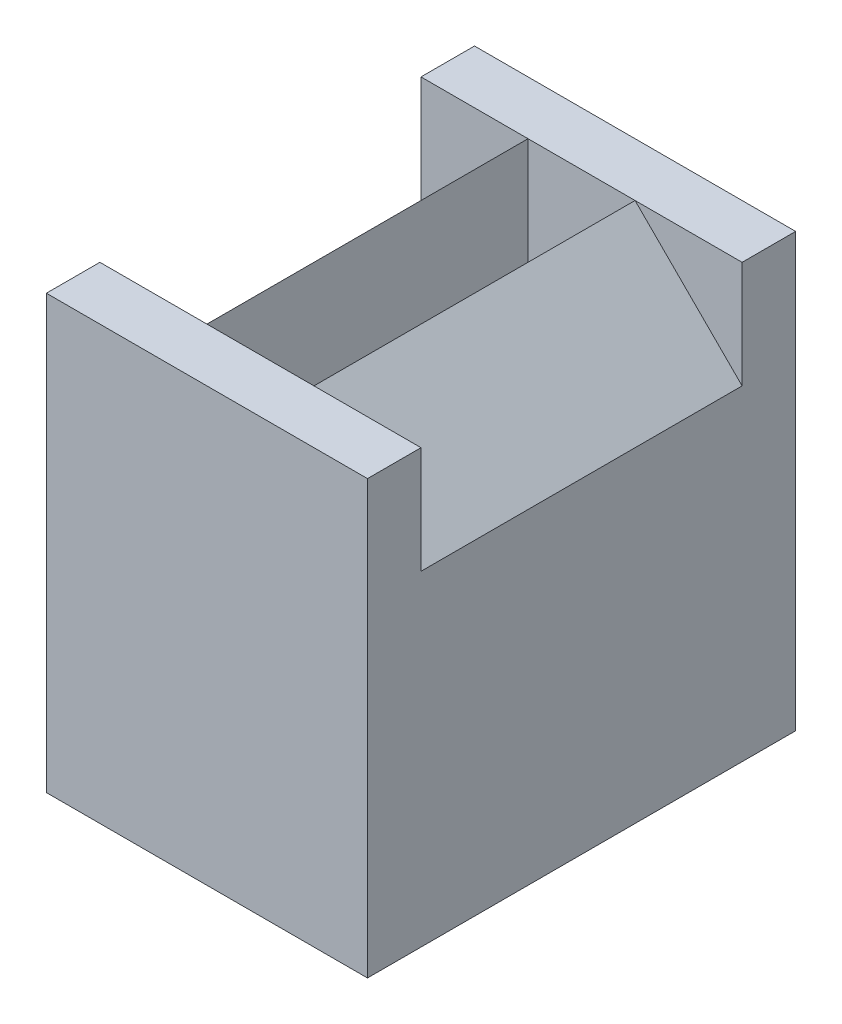
from build123d import *

# Parameters (mm, degrees)
BOSS_EXTRUDE2_DEPTH = 40
SKETCH2_5_W         = 20
SKETCH2_5_H         = 20
BOSS_EXTRUDE3_DEPTH = 10


with BuildPart() as part:
    # Sketch2 → Boss-Extrude2 (new body)
    with BuildSketch(Plane.XY):
        Polygon((30, 20.406682394), (10, 40.406682394), (10, 20.406682394), (-10, 20.406682394), (-10, 40.406682394), (-30, 20.406682394), (-30, -40.406682394), (30, -40.406682394), align=None)
    extrude(amount=BOSS_EXTRUDE2_DEPTH)

    # Sketch2<5> → Boss-Extrude3 (add)
    with BuildSketch(Plane.XY):
        Polygon((30, 40.406682394), (10, 40.406682394), (30, 20.406682394), align=None)
        with Locations((0, 30.406682394)):
            Rectangle(SKETCH2_5_W, SKETCH2_5_H)
        Polygon((-30, 20.406682394), (-10, 40.406682394), (-30, 40.406682394), align=None)
    extrude(amount=BOSS_EXTRUDE3_DEPTH)

    # Mirror1: part across plane


with BuildPart() as part_1:
    add(part.part)
    add(part.part.mirror(Plane.XY.offset(40)))


solid = part_1.part
